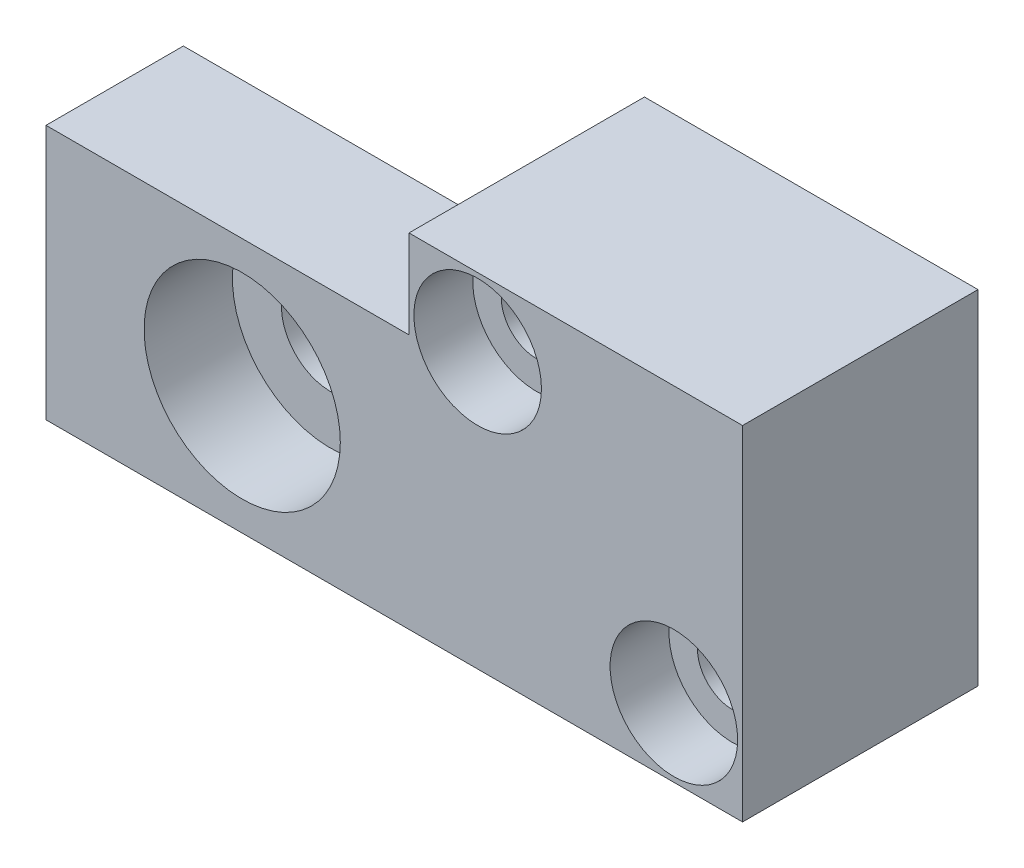
from build123d import *

# Parameters (mm, degrees)
SKETCH_1_W                   = 35.5
SKETCH_1_H                   = 17.5
EXTRUDE_1_DEPTH              = 12
SKETCH_2_W                   = 18.5
SKETCH_2_H                   = 4.5
CUT_EXTRUDE_1_DEPTH          = 42.35819145
SKETCH_3_R                   = 5
CUT_EXTRUDE_2_DEPTH          = 4.5
HOLE_WIZARD_M3_1_D           = 3.6
HOLE_WIZARD_M3_1_CBORE_D     = 6.5
HOLE_WIZARD_M3_1_CBORE_DEPTH = 3
SKETCH_8_R                   = 2.5
CUT_EXTRUDE_3_DEPTH          = 41.283371259
SKETCH_10_W                  = 17
SKETCH_10_H                  = 13
CUT_EXTRUDE_4_DEPTH          = 5


with BuildPart() as part:
    # 草图1 → 凸台-拉伸1 (new body)
    with BuildSketch(Plane.XY):
        with Locations((17.75, 8.75)):
            Rectangle(SKETCH_1_W, SKETCH_1_H)
    extrude(amount=EXTRUDE_1_DEPTH)

    # 草图2 → 切除-拉伸1 (cut, through all)
    with BuildSketch(Plane.XY.offset(12)):
        with Locations((9.25, 15.25)):
            Rectangle(SKETCH_2_W, SKETCH_2_H)
    extrude(amount=-CUT_EXTRUDE_1_DEPTH, mode=Mode.SUBTRACT)

    # 草图3 → 切除-拉伸2 (cut)
    with BuildSketch(Plane.XY.offset(12)):
        with Locations((10, 6.5)):
            Circle(SKETCH_3_R)
    extrude(amount=-CUT_EXTRUDE_2_DEPTH, mode=Mode.SUBTRACT)

    # M3 六角凹头螺钉的柱形沉头孔1 (through all)
    with Locations(Plane.XY.offset(12)):
        with Locations((22, 14), (32, 3.5)):
            CounterBoreHole(HOLE_WIZARD_M3_1_D / 2, HOLE_WIZARD_M3_1_CBORE_D / 2, HOLE_WIZARD_M3_1_CBORE_DEPTH)

    # 草图8 → 切除-拉伸3 (cut, through all)
    with BuildSketch(Plane.XY.offset(7.5)):
        with Locations((10, 6.5)):
            Circle(SKETCH_8_R)
    extrude(amount=-CUT_EXTRUDE_3_DEPTH, mode=Mode.SUBTRACT)

    # 草图10 → 切除-拉伸4 (cut)
    with BuildSketch(Plane(origin=(0, 0, 0), x_dir=(-1, 0, 0), z_dir=(0, 0, -1))):
        with Locations((-8.5, 6.5)):
            Rectangle(SKETCH_10_W, SKETCH_10_H)
    extrude(amount=-CUT_EXTRUDE_4_DEPTH, mode=Mode.SUBTRACT)


solid = part.part
